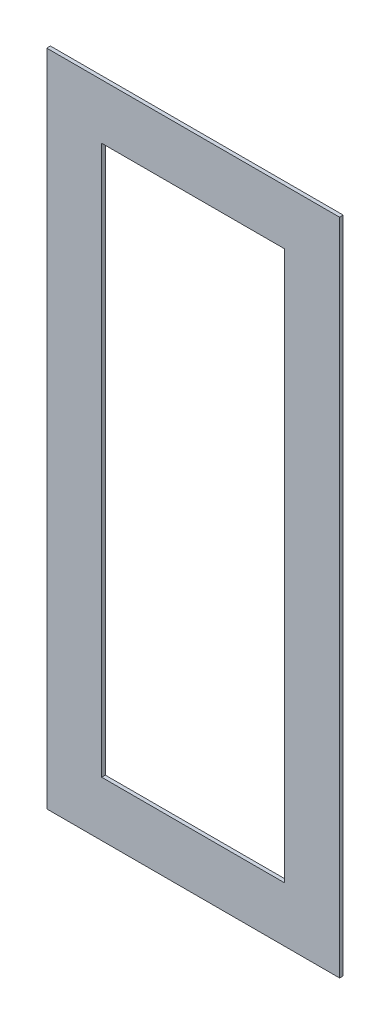
from build123d import *

# Parameters (mm, degrees)
SKETCH1_W           = 16
SKETCH1_H           = 36
SKETCH1_W_2         = 10
SKETCH1_H_2         = 30
BOSS_EXTRUDE1_DEPTH = 0.2


with BuildPart() as part:
    # Sketch1 → Boss-Extrude1 (new body)
    with BuildSketch(Plane.XY):
        Rectangle(SKETCH1_W, SKETCH1_H)
        Rectangle(SKETCH1_W_2, SKETCH1_H_2, mode=Mode.SUBTRACT)
    extrude(amount=BOSS_EXTRUDE1_DEPTH)


solid = part.part
